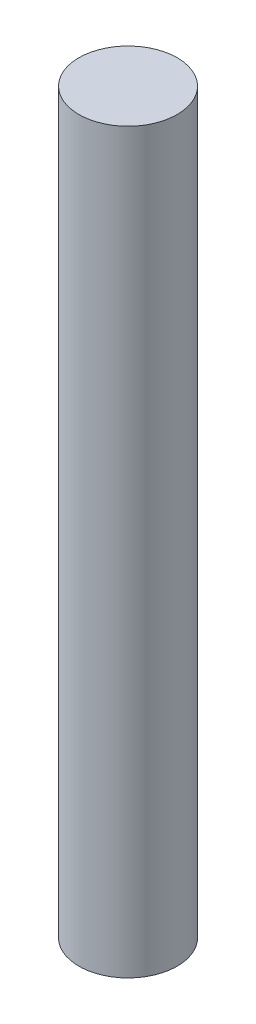
from build123d import *

# Parameters (mm, degrees)
SKETCH1_R           = 5.08
BOSS_EXTRUDE1_DEPTH = 76.2


with BuildPart() as part:
    # Sketch1 → Boss-Extrude1 (new body)
    with BuildSketch(Plane(origin=(0, 0, 0), x_dir=(1, 0, 0), z_dir=(0, 1, 0))):
        with Locations(Location((0, 0, 0), (0, 0, 90))):
            Circle(SKETCH1_R)
    extrude(amount=BOSS_EXTRUDE1_DEPTH)


solid = part.part
